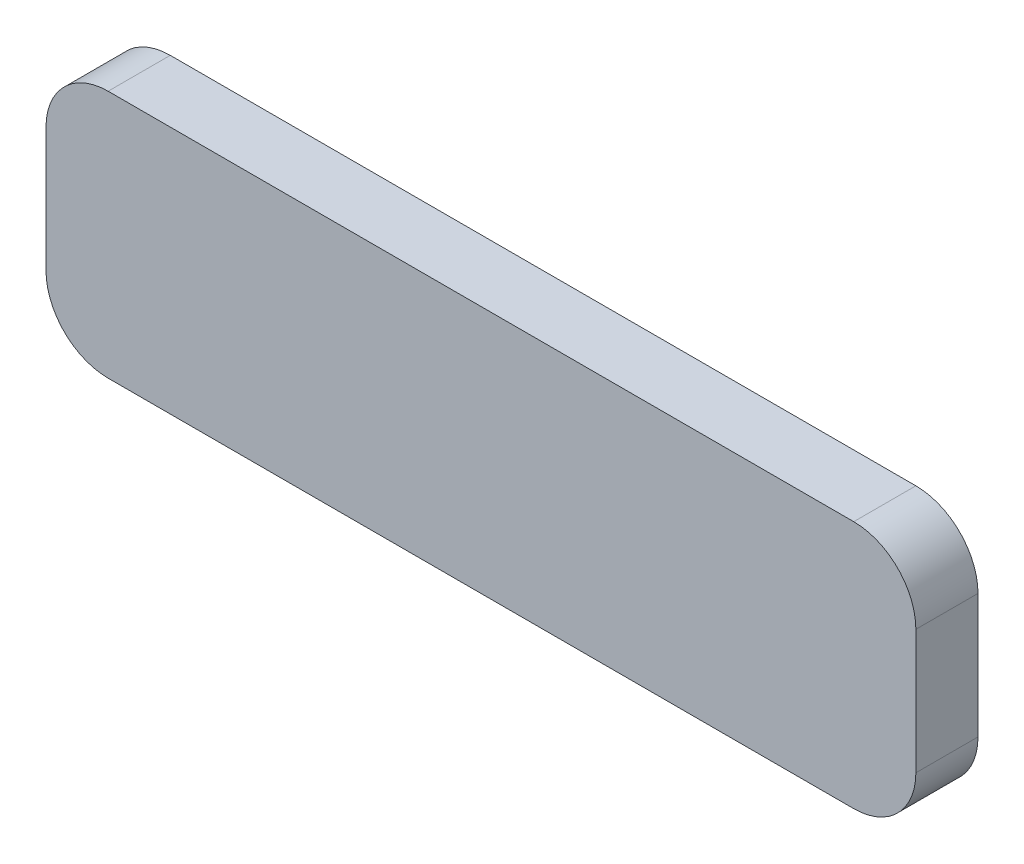
from build123d import *

# Parameters (mm, degrees)
AUFSATZ_LINEAR_AUSTRAGEN1_DEPTH = 1


with BuildPart() as part:
    # Skizze1 → Aufsatz-Linear austragen1 (new body)
    with BuildSketch(Plane.XY):
        with BuildLine():
            Line((1, 0), (13, 0))
            ThreePointArc((13, 0), (13.707106781, 0.292893219), (14, 1))
            Line((14, 1), (14, 3))
            ThreePointArc((14, 3), (13.707106781, 3.707106781), (13, 4))
            Line((13, 4), (1, 4))
            ThreePointArc((1, 4), (0.292893219, 3.707106781), (0, 3))
            Line((0, 3), (0, 1))
            ThreePointArc((0, 1), (0.292893219, 0.292893219), (1, 0))
        make_face()
    extrude(amount=AUFSATZ_LINEAR_AUSTRAGEN1_DEPTH)


solid = part.part
